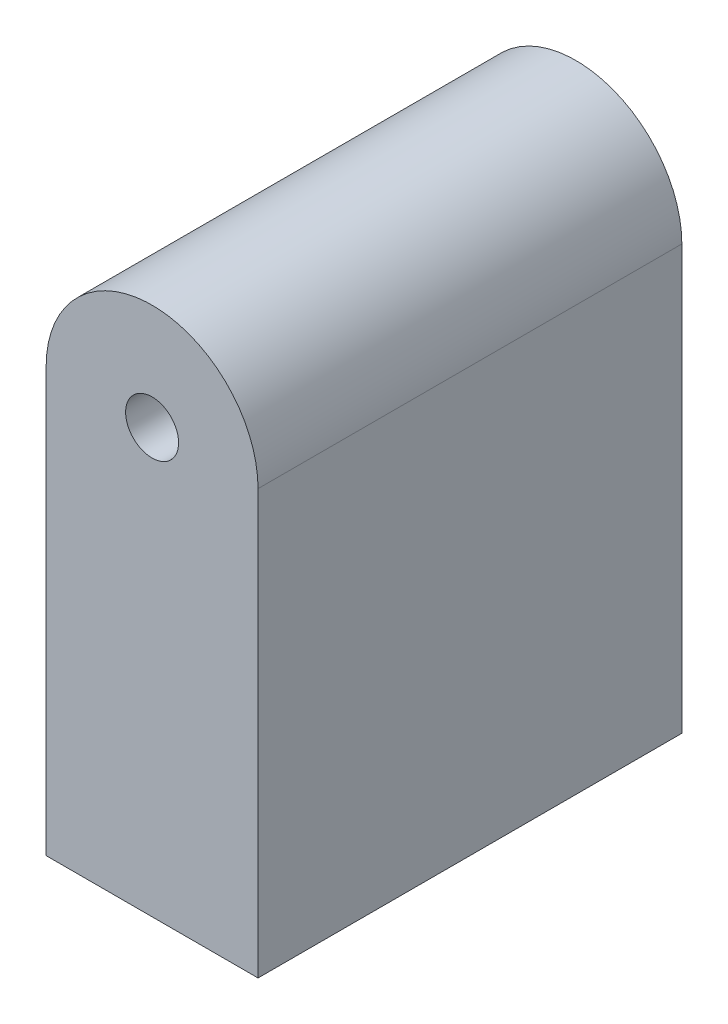
from build123d import *

# Parameters (mm, degrees)
BOSS_EXTRUDE1_DEPTH = 50.8


with BuildPart() as part:
    # Sketch1 → Boss-Extrude1 (new body)
    with BuildSketch(Plane.XY):
        with BuildLine():
            ThreePointArc((25.4, 50.8), (12.7, 63.5), (0, 50.8))
            Line((0, 50.8), (9.525, 50.8))
            ThreePointArc((9.525, 50.8), (12.7, 53.975), (15.875, 50.8))
            Line((15.875, 50.8), (25.4, 50.8))
        make_face()
        with BuildLine():
            Line((9.525, 50.8), (0, 50.8))
            ThreePointArc((0, 50.8), (12.7, 38.1), (25.4, 50.8))
            Line((25.4, 50.8), (15.875, 50.8))
            ThreePointArc((15.875, 50.8), (12.7, 47.625), (9.525, 50.8))
        make_face()
        with BuildLine():
            Line((0, 50.8), (0, 0))
            Line((0, 0), (25.4, 0))
            Line((25.4, 0), (25.4, 50.8))
            ThreePointArc((25.4, 50.8), (12.7, 38.1), (0, 50.8))
        make_face()
    extrude(amount=BOSS_EXTRUDE1_DEPTH)


solid = part.part
